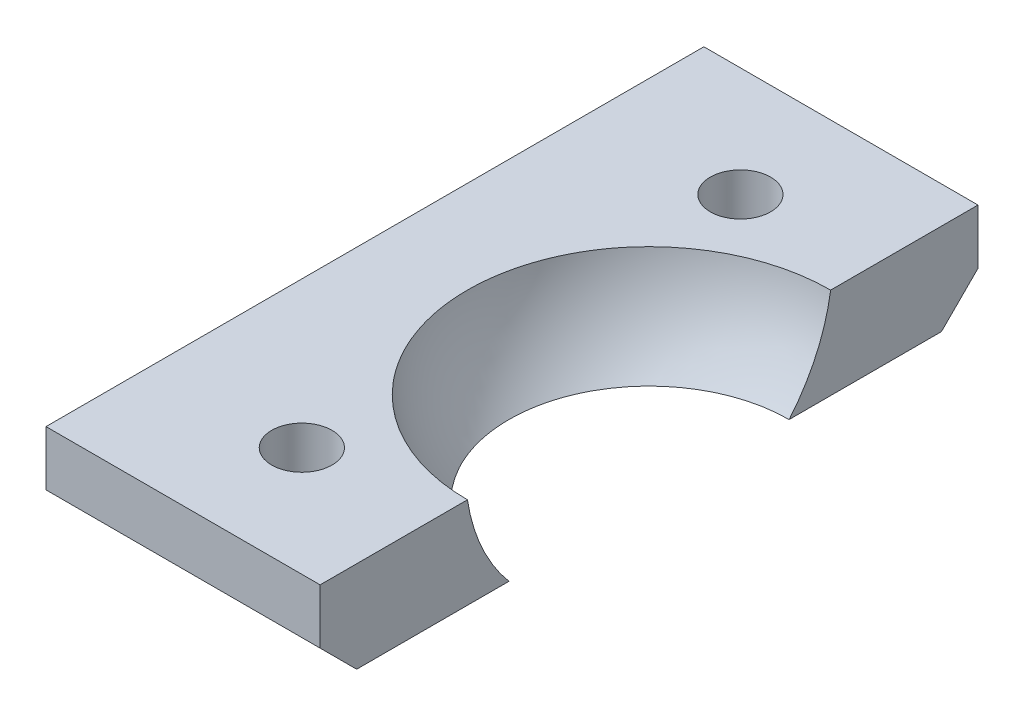
from build123d import *

# Parameters (mm, degrees)
SKETCH_1_W          = 30
SKETCH_1_H          = 50
EXTRUDE_1_DEPTH     = 5
SKETCH_3_R          = 1.65
CUT_EXTRUDE_1_DEPTH = 59.523499554
SKETCH_4_W          = 41.234400122
SKETCH_4_H          = 9.68197476
SKETCH_4_W_2        = 47.672667602
SKETCH_4_H_2        = 11.058093
CUT_EXTRUDE_2_DEPTH = 59.523499554
SKETCH_5_W          = 20.505917257
SKETCH_5_H          = 40.348212596
CUT_EXTRUDE_3_DEPTH = 53.668776329
CHAMFER_1_SIZE      = 2


with BuildPart() as part:
    # 草图1 → 凸台-拉伸1 (new body)
    with BuildSketch(Plane(origin=(0, 0, 0), x_dir=(1, 0, 0), z_dir=(0, 1, 0))):
        with Locations((15, -25)):
            Rectangle(SKETCH_1_W, SKETCH_1_H)
    extrude(amount=EXTRUDE_1_DEPTH)

    # 草图2 → 切除-旋转1 (revolve, cut)
    with BuildSketch(Plane(origin=(0, 6.5, 0), x_dir=(1, 0, 0), z_dir=(0, 1, 0))):
        with BuildLine():
            Line((4.95, -25), (25.05, -25))
            ThreePointArc((25.05, -25), (15, -35.05), (4.95, -25))
        make_face()
    revolve(axis=Axis((4.95, 6.5, 25), (1, 0, 0)), mode=Mode.SUBTRACT)

    # 草图3 → 切除-拉伸1 (cut, through all)
    with BuildSketch(Plane(origin=(0, 0, 0), x_dir=(-1, 0, 0), z_dir=(0, -1, 0))):
        with Locations(Location((-8, -37, 0), (0, 0, 90))):
            Circle(SKETCH_3_R)
        with Locations(Location((-22, -37, 0), (0, 0, 90))):
            Circle(SKETCH_3_R)
        with Locations(Location((-8, -13, 0), (0, 0, 90))):
            Circle(SKETCH_3_R)
        with Locations(Location((-22, -13, 0), (0, 0, 90))):
            Circle(SKETCH_3_R)
    extrude(amount=-CUT_EXTRUDE_1_DEPTH, mode=Mode.SUBTRACT)

    # 草图4 → 切除-拉伸2 (cut, through all)
    with BuildSketch(Plane(origin=(0, 5, 0), x_dir=(1, 0, 0), z_dir=(0, 1, 0))):
        with Locations((14.53310274, -2.15901262)):
            Rectangle(SKETCH_4_W, SKETCH_4_H)
        with Locations((15.58976496, -48.5290465)):
            Rectangle(SKETCH_4_W_2, SKETCH_4_H_2)
    extrude(amount=-CUT_EXTRUDE_2_DEPTH, mode=Mode.SUBTRACT)

    # 草图5 → 切除-拉伸3 (cut, through all)
    with BuildSketch(Plane(origin=(0, 5, 0), x_dir=(1, 0, 0), z_dir=(0, 1, 0))):
        with Locations((25.252958629, -25.047535921)):
            Rectangle(SKETCH_5_W, SKETCH_5_H)
    extrude(amount=-CUT_EXTRUDE_3_DEPTH, mode=Mode.SUBTRACT)

    # 倒角1
    chamfer_1_edges = [part.edges().sort_by_distance(p)[0] for p in [
        (0, 0, 25),
        (7.5, 0, 7),
        (7.5, 0, 43),
    ]]
    chamfer(chamfer_1_edges, length=CHAMFER_1_SIZE)


solid = part.part
